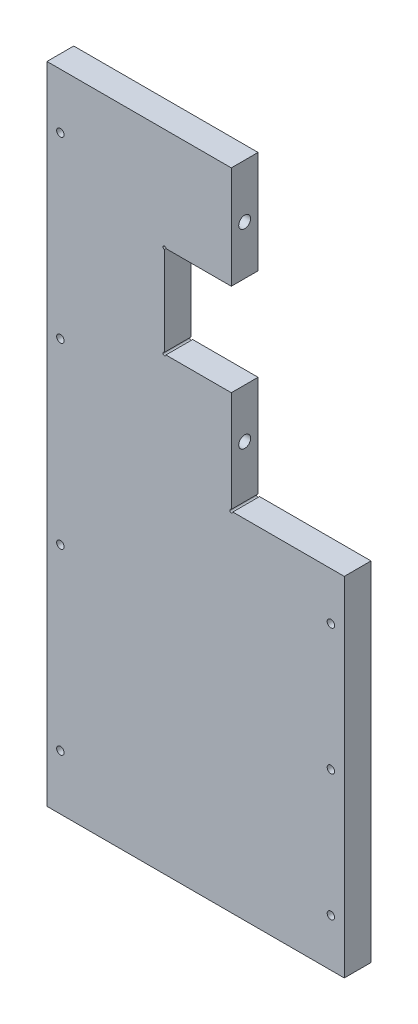
from build123d import *

# Parameters (mm, degrees)
BOSS_EXTRUDE1_DEPTH          = 18
SKETCH2_R                    = 1
CUT_EXTRUDE1_DEPTH           = 18
F_5_0_5_DIAMETER_HOLE1_D     = 5
F_5_0_5_DIAMETER_HOLE2_D     = 5
F_8_0_8_DIAMETER_HOLE1_D     = 8
F_8_0_8_DIAMETER_HOLE1_DEPTH = 26


with BuildPart() as part:
    # Sketch1 → Boss-Extrude1 (new body)
    with BuildSketch(Plane.XY):
        Polygon((200, 234), (124, 234), (124, 303), (79, 303), (79, 365), (124, 365), (124, 434), (0, 434), (0, 0), (200, 0), align=None)
    extrude(amount=BOSS_EXTRUDE1_DEPTH)

    # Sketch2 → Cut-Extrude1 (cut)
    with BuildSketch(Plane.XY.offset(18)):
        with Locations((79, 365)):
            Circle(SKETCH2_R)
        with Locations((79, 303)):
            Circle(SKETCH2_R)
        with Locations((124, 234)):
            Circle(SKETCH2_R)
    extrude(amount=-CUT_EXTRUDE1_DEPTH, mode=Mode.SUBTRACT)

    # Ø5.0 (5) Diameter Hole1 (through all)
    with Locations(Plane.XY.offset(18)):
        with Locations((9, 397), (9, 277), (9, 157), (9, 37)):
            Hole(F_5_0_5_DIAMETER_HOLE1_D / 2)

    # Ø5.0 (5) Diameter Hole2 (through all)
    with Locations(Plane(origin=(0, 0, 0), x_dir=(-1, 0, 0), z_dir=(0, 0, -1))):
        with Locations((-191, 202), (-191, 117), (-191, 32)):
            Hole(F_5_0_5_DIAMETER_HOLE2_D / 2)

    # Ø8.0 (8) Diameter Hole1
    with Locations(Plane(origin=(124, 0, 0), x_dir=(0, 0, -1), z_dir=(1, 0, 0))):
        with Locations((-9, 398), (-9, 270)):
            Hole(F_8_0_8_DIAMETER_HOLE1_D / 2, depth=F_8_0_8_DIAMETER_HOLE1_DEPTH)


solid = part.part
